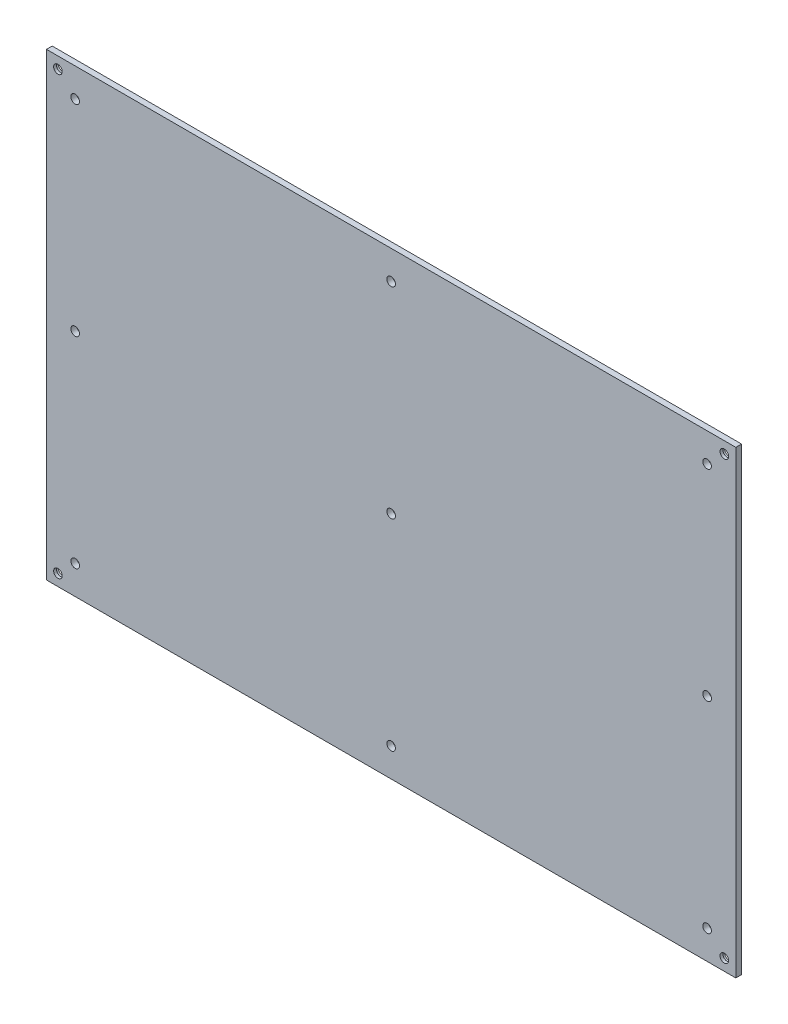
from build123d import *

# Parameters (mm, degrees)
SKETCH1_W           = 240
SKETCH1_H           = 160
BOSS_EXTRUDE1_DEPTH = 2
SKETCH5_R           = 1.5
CUT_EXTRUDE2_DEPTH  = 4
SKETCH6_R           = 2
CUT_EXTRUDE3_DEPTH  = 1
SKETCH7_R           = 1.5
CUT_EXTRUDE4_DEPTH  = 1


with BuildPart() as part:
    # Sketch1 → Boss-Extrude1 (new body)
    with BuildSketch(Plane.XY):
        Rectangle(SKETCH1_W, SKETCH1_H)
    extrude(amount=BOSS_EXTRUDE1_DEPTH)

    # Sketch5 → Cut-Extrude2 (cut)
    with BuildSketch(Plane.XY.offset(2)):
        with Locations((-110, 70)):
            Circle(SKETCH5_R)
        with Locations((0, 70)):
            Circle(SKETCH5_R)
        with Locations((110, 70)):
            Circle(SKETCH5_R)
        Circle(SKETCH5_R)
        with Locations((110, 0)):
            Circle(SKETCH5_R)
        with Locations((0, -70)):
            Circle(SKETCH5_R)
        with Locations((110, -70)):
            Circle(SKETCH5_R)
        with Locations((-110, 0)):
            Circle(SKETCH5_R)
        with Locations((-110, -70)):
            Circle(SKETCH5_R)
    extrude(amount=-CUT_EXTRUDE2_DEPTH, mode=Mode.SUBTRACT)

    # Sketch6 → Cut-Extrude3 (cut)
    with BuildSketch(Plane(origin=(0, 0, 0), x_dir=(-1, 0, 0), z_dir=(0, 0, -1))):
        with Locations((116, -76)):
            Circle(SKETCH6_R)
        with Locations((116, 76)):
            Circle(SKETCH6_R)
        with Locations((-116, 76)):
            Circle(SKETCH6_R)
        with Locations((-116, -76)):
            Circle(SKETCH6_R)
    extrude(amount=-CUT_EXTRUDE3_DEPTH, mode=Mode.SUBTRACT)

    # Sketch7 → Cut-Extrude4 (cut)
    with BuildSketch(Plane(origin=(0, 0, 1), x_dir=(-1, 0, 0), z_dir=(0, 0, -1))):
        with Locations((116, -76)):
            Circle(SKETCH7_R)
        with Locations((116, 76)):
            Circle(SKETCH7_R)
        with Locations((-116, 76)):
            Circle(SKETCH7_R)
        with Locations((-116, -76)):
            Circle(SKETCH7_R)
    extrude(amount=-CUT_EXTRUDE4_DEPTH, mode=Mode.SUBTRACT)


solid = part.part
